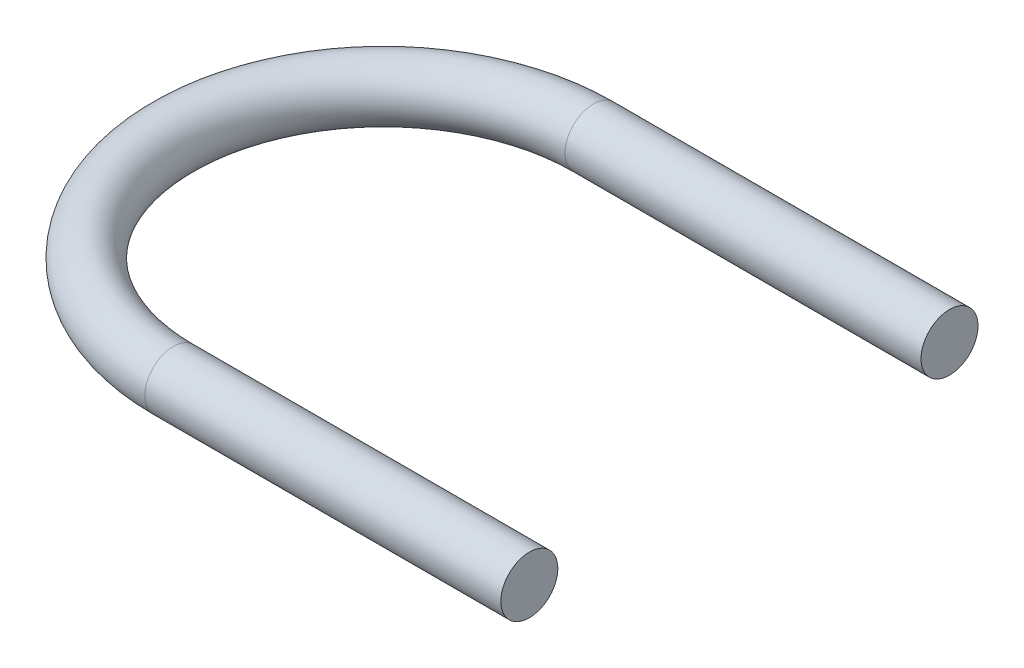
from build123d import *

# Parameters (mm, degrees)
SWEEP2_PROFILE_R = 4


with BuildPart() as part:
    # Sweep2: sweep along a path in Sketch2
    with BuildLine(Plane(origin=(0, 0, 0), x_dir=(1, 0, 0), z_dir=(0, 1, 0))) as sweep2_path:
        Line((50, 29.5), (0, 29.5))
        ThreePointArc((0, 29.5), (-29.5, 0), (0, -29.5))
        Line((0, -29.5), (50, -29.5))
    # Sweep2 profile (on start of the path) → Sweep2 (sweep)
    with BuildSketch(Plane(origin=(50, 0, -29.5), x_dir=(0, 0, -1), z_dir=(-1, 0, 0))):
        Circle(SWEEP2_PROFILE_R)
    sweep(path=sweep2_path.line)


solid = part.part
